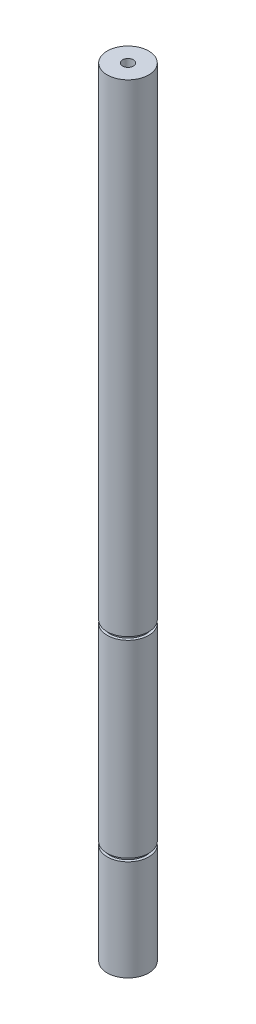
from build123d import *

# Parameters (mm, degrees)
SKETCH_1_R             = 8
EXTRUDE_1_DEPTH        = 150
SKETCH_5_W             = 1
SKETCH_5_H             = 1.2
PATTERN_LINEAR_1_COUNT = 2
PATTERN_LINEAR_1_PITCH = 74


with BuildPart() as part:
    # 草图1 → 凸台-拉伸1 (new, symmetric)
    with BuildSketch(Plane(origin=(0, 0, 0), x_dir=(1, 0, 0), z_dir=(0, 1, 0))):
        with Locations(Location((0, 0, 0), (0, 0, 270))):
            Circle(SKETCH_1_R)
    extrude(amount=EXTRUDE_1_DEPTH, both=True)

    # 草图3 → M5 螺纹孔1 (revolve, cut)
    with BuildSketch(Plane(origin=(0, 150, 0), x_dir=(0, 0, 1), z_dir=(1, 0, 0))):
        Polygon((0, 0), (0, 15.2618073), (2.1, 14), (2.1, 0), align=None)
    hole_wizard_m5_1 = revolve(axis=Axis((0, 156.35, 0), (0, -1, 0)), mode=Mode.SUBTRACT)

    # 镜向1: M5 螺纹孔1 across plane
    add(hole_wizard_m5_1.mirror(Plane.ZX), mode=Mode.SUBTRACT)

    # 草图5 → 切除-旋转1 (revolve, cut)
    with BuildSketch(Plane.XY, mode=Mode.PRIVATE) as cut_revolve_1_sk:
        with Locations((7.5, -110.6)):
            Rectangle(SKETCH_5_W, SKETCH_5_H)
    cut_revolve_1 = revolve(cut_revolve_1_sk.sketch.rotate(Axis((0, 150, 0), (0, -1, 0)), 90), axis=Axis((0, 150, 0), (0, -1, 0)), mode=Mode.SUBTRACT)

    # 阵列(线性)1: 切除-旋转1 ×2
    with Locations(*[(0, i * PATTERN_LINEAR_1_PITCH, 0) for i in range(1, PATTERN_LINEAR_1_COUNT)]):
        add(cut_revolve_1, mode=Mode.SUBTRACT)


solid = part.part
